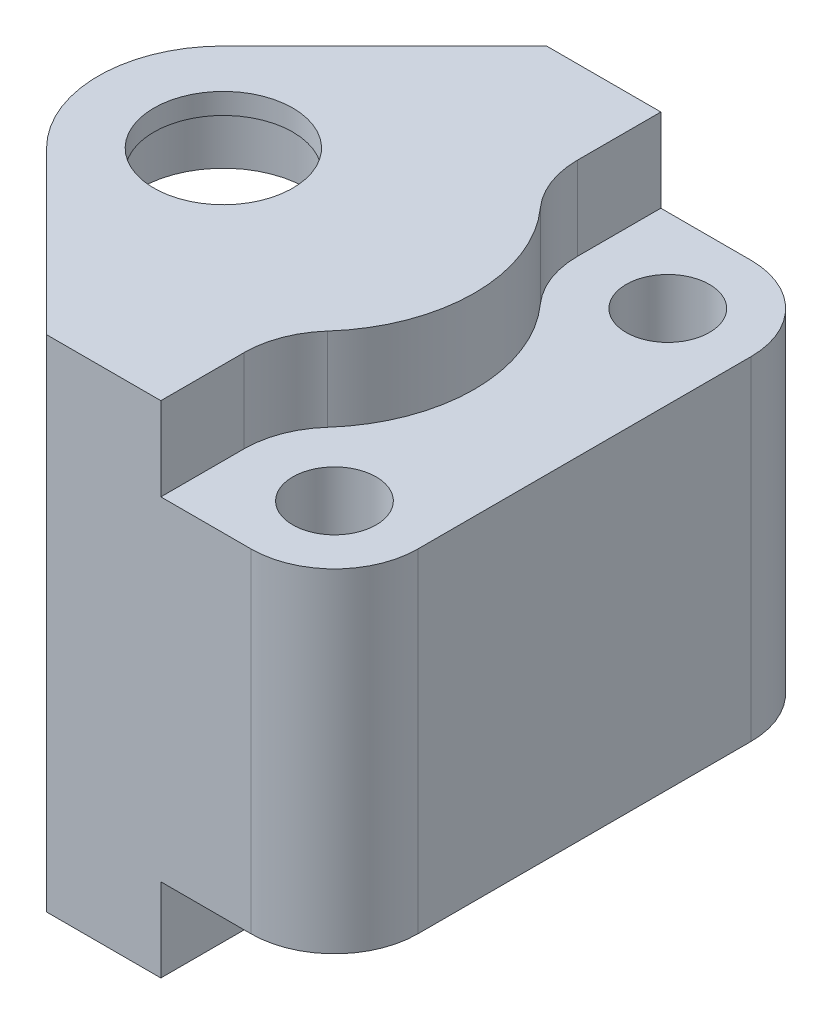
from build123d import *

# Parameters (mm, degrees)
SKETCH1_R           = 1.5
BOSS_EXTRUDE1_DEPTH = 9
CUT_EXTRUDE1_DEPTH  = 6.25
CUT_EXTRUDE2_START  = 9
CUT_EXTRUDE2_DEPTH  = 3
CUT_EXTRUDE3_START  = -6
CUT_EXTRUDE3_DEPTH  = 3


with BuildPart() as part:
    # Sketch1 → Boss-Extrude1 (new, symmetric)
    with BuildSketch(Plane(origin=(0, 0, 0), x_dir=(1, 0, 0), z_dir=(0, 1, 0))):
        with BuildLine():
            Line((13, 6), (13, -6))
            ThreePointArc((13, -6), (12.121320344, -8.121320344), (10, -9))
            Line((10, -9), (2.636038969, -9))
            Line((2.636038969, -9), (-3.181980515, -3.181980515))
            ThreePointArc((-3.181980515, -3.181980515), (-4.5, 0), (-3.181980515, 3.181980515))
            Line((-3.181980515, 3.181980515), (2.636038969, 9))
            Line((2.636038969, 9), (10, 9))
            ThreePointArc((10, 9), (12.121320344, 8.121320344), (13, 6))
        make_face()
        with Locations(Location((10, 6, 0), (0, 0, 270))):
            Circle(SKETCH1_R, mode=Mode.SUBTRACT)
        with Locations(Location((10, -6, 0), (0, 0, 270))):
            Circle(SKETCH1_R, mode=Mode.SUBTRACT)
    extrude(amount=BOSS_EXTRUDE1_DEPTH, both=True)

    # Sketch2 → Cut-Extrude1 (cut, symmetric)
    with BuildSketch(Plane(origin=(0, 0, 0), x_dir=(1, 0, 0), z_dir=(0, 1, 0))):
        with BuildLine():
            Line((5.000969408, 1.597749973), (2.636038969, 9))
            Line((2.636038969, 9), (-3.181980515, 3.181980515))
            ThreePointArc((-3.181980515, 3.181980515), (-4.5, 0), (-3.181980515, -3.181980515))
            Line((-3.181980515, -3.181980515), (2.636038969, -9))
            Line((2.636038969, -9), (5.000969408, -1.597749973))
            ThreePointArc((5.000969408, -1.597749973), (5.25, 0), (5.000969408, 1.597749973))
        make_face()
    extrude(amount=CUT_EXTRUDE1_DEPTH, both=True, mode=Mode.SUBTRACT)

    # Sketch3 → Cut-Revolve1 (revolve, cut)
    with BuildSketch(Plane.XY, mode=Mode.PRIVATE) as cut_revolve1_sk:
        Polygon((-2.5, 9), (-2.5, 8.25), (-3, 8.25), (-3, 6.25), (0, 6.25), (0, 9), align=None)
        Polygon((0, -6.25), (0, -9), (-2.5, -9), (-2.5, -8.25), (-3, -8.25), (-3, -6.25), align=None)
    revolve(cut_revolve1_sk.sketch.rotate(Axis((0, -11.503843925, 0), (0, 1, 0)), 270), axis=Axis((0, -11.503843925, 0), (0, 1, 0)), mode=Mode.SUBTRACT)

    # Sketch4 → Cut-Extrude2 (cut)
    with BuildSketch(Plane(origin=(0, 0, 0), x_dir=(1, 0, 0), z_dir=(0, 1, 0)).offset(CUT_EXTRUDE2_START)):
        with BuildLine():
            Line((6.75, -9), (10, -9))
            ThreePointArc((10, -9), (12.121320344, -8.121320344), (13, -6))
            Line((13, -6), (13, 6))
            ThreePointArc((13, 6), (12.121320344, 8.121320344), (10, 9))
            Line((10, 9), (6.75, 9))
            Line((6.75, 9), (6.75, 6))
            ThreePointArc((6.75, 6), (6.963939833, 4.840328208), (7.577593024, 3.833333333))
            ThreePointArc((7.577593024, 3.833333333), (9.041796068, 0), (7.577593024, -3.833333333))
            ThreePointArc((7.577593024, -3.833333333), (6.963939833, -4.840328208), (6.75, -6))
            Line((6.75, -6), (6.75, -9))
        make_face()
    extrude(amount=-CUT_EXTRUDE2_DEPTH, mode=Mode.SUBTRACT)

    # Sketch4<2> → Cut-Extrude3 (cut)
    with BuildSketch(Plane(origin=(0, 0, 0), x_dir=(1, 0, 0), z_dir=(0, 1, 0)).offset(CUT_EXTRUDE3_START)):
        with BuildLine():
            Line((6.75, -9), (10, -9))
            ThreePointArc((10, -9), (12.121320344, -8.121320344), (13, -6))
            Line((13, -6), (13, 6))
            ThreePointArc((13, 6), (12.121320344, 8.121320344), (10, 9))
            Line((10, 9), (6.75, 9))
            Line((6.75, 9), (6.75, 6))
            ThreePointArc((6.75, 6), (6.963939833, 4.840328208), (7.577593024, 3.833333333))
            ThreePointArc((7.577593024, 3.833333333), (9.041796068, 0), (7.577593024, -3.833333333))
            ThreePointArc((7.577593024, -3.833333333), (6.963939833, -4.840328208), (6.75, -6))
            Line((6.75, -6), (6.75, -9))
        make_face()
    extrude(amount=-CUT_EXTRUDE3_DEPTH, mode=Mode.SUBTRACT)


solid = part.part
